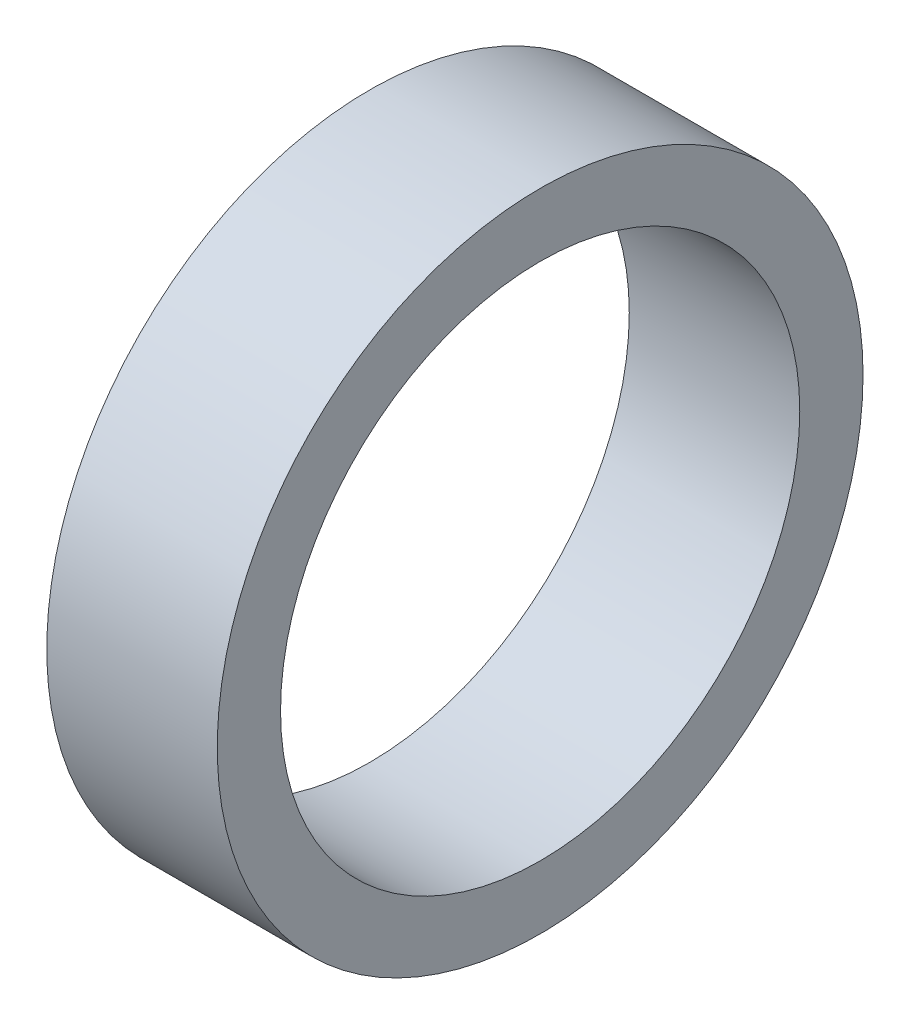
from build123d import *

# Parameters (mm, degrees)
SKETCH1_R           = 15.875
BOSS_EXTRUDE1_DEPTH = 8.382
CUT_EXTRUDE1_REACH  = 25.964
SKETCH2_R           = 12.7635


with BuildPart() as part:
    # Sketch1 → Boss-Extrude1 (new body)
    with BuildSketch(Plane(origin=(0, 0, 0), x_dir=(0, 0, -1), z_dir=(1, 0, 0))):
        Circle(SKETCH1_R)
    extrude(amount=BOSS_EXTRUDE1_DEPTH)

    # Sketch2 → Cut-Extrude1 (cut, up to next)
    with BuildSketch(Plane(origin=(8.382, 0, 0), x_dir=(0, 0, -1), z_dir=(1, 0, 0)), mode=Mode.PRIVATE) as cut_extrude1_sk1:
        Circle(SKETCH2_R)
    cut_extrude1_tool1 = extrude(cut_extrude1_sk1.sketch, amount=-CUT_EXTRUDE1_REACH, mode=Mode.PRIVATE) & part.part
    add(cut_extrude1_tool1.solids().sort_by_distance((8.382, 0, 0))[0], mode=Mode.SUBTRACT)


solid = part.part
